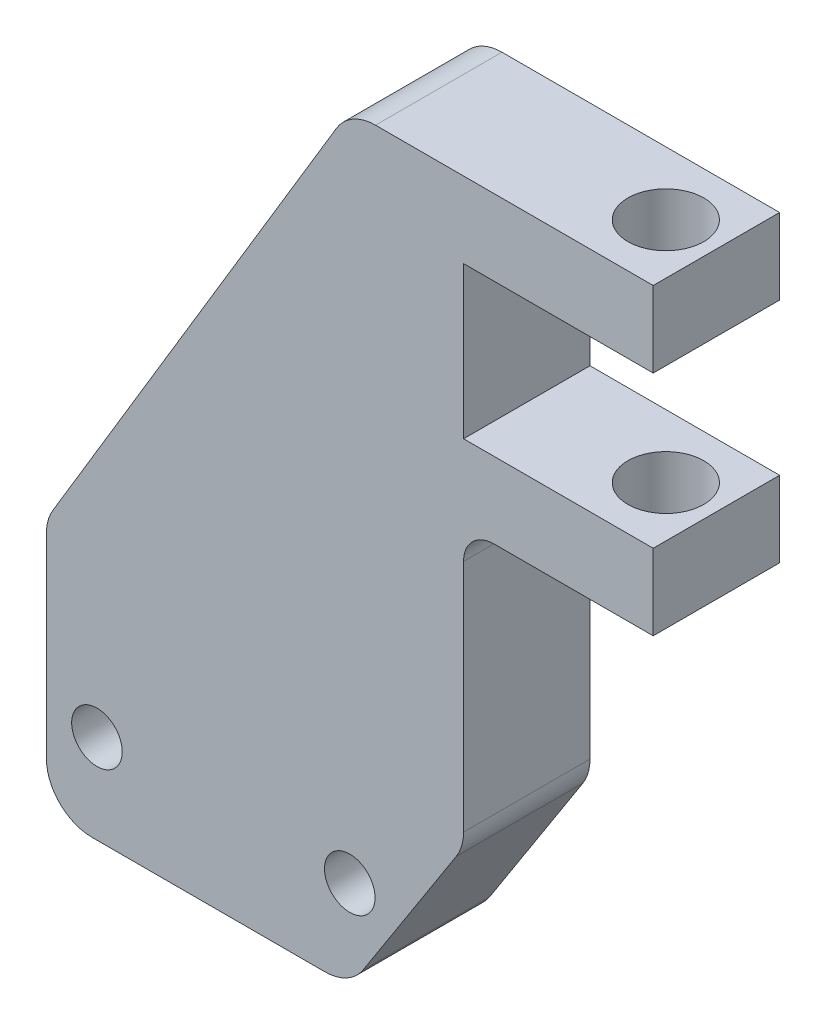
from build123d import *

# Parameters (mm, degrees)
SKETCH1_R      = 1
EXTRUDE1_DEPTH = 5
FILLET2_R      = 1.8
FILLET3_R      = 1.2
SKETCH3_R      = 1.5
EXTRUDE2_DEPTH = 17


with BuildPart() as part:
    # Sketch1 → Extrude1 (new body)
    with BuildSketch(Plane.XY):
        Polygon((7.038618211, 6.213258786), (7.038618211, 16.213258786), (19.038618211, 36.213258786), (31.038618211, 36.213258786), (31.038618211, 33.213258786), (23.538618211, 33.213258786), (23.538618211, 27.213258786), (31.038618211, 27.213258786), (31.038618211, 24.213258786), (23.538618211, 24.213258786), (23.538618211, 13.213258786), (19.038618211, 6.213258786), align=None)
        with Locations((9.038618211, 9.738237996)):
            Circle(SKETCH1_R, mode=Mode.SUBTRACT)
        with Locations((19.038618211, 9.738237996)):
            Circle(SKETCH1_R, mode=Mode.SUBTRACT)
    extrude(amount=EXTRUDE1_DEPTH)

    # Fillet2
    fillet2_edges = [part.edges().sort_by_distance(p)[0] for p in [
        (7.038618211, 6.213258786, 2.5),
        (7.038618211, 16.213258786, 2.5),
        (19.038618211, 36.213258786, 2.5),
        (23.538618211, 13.213258786, 2.5),
        (19.038618211, 6.213258786, 2.5),
    ]]
    fillet(fillet2_edges, radius=FILLET2_R)

    # Fillet3
    fillet3_edges = [part.edges().sort_by_distance(p)[0] for p in [
        (23.538618211, 24.213258786, 2.5),
    ]]
    fillet(fillet3_edges, radius=FILLET3_R)

    # Sketch3 → Extrude2 (cut)
    with BuildSketch(Plane(origin=(0, 36.213258786, 0), x_dir=(1, 0, 0), z_dir=(0, 1, 0))):
        with Locations(Location((29.038618211, -2.5, 0), (0, 0, 180))):
            Circle(SKETCH3_R)
    extrude(amount=-EXTRUDE2_DEPTH, mode=Mode.SUBTRACT)


solid = part.part
